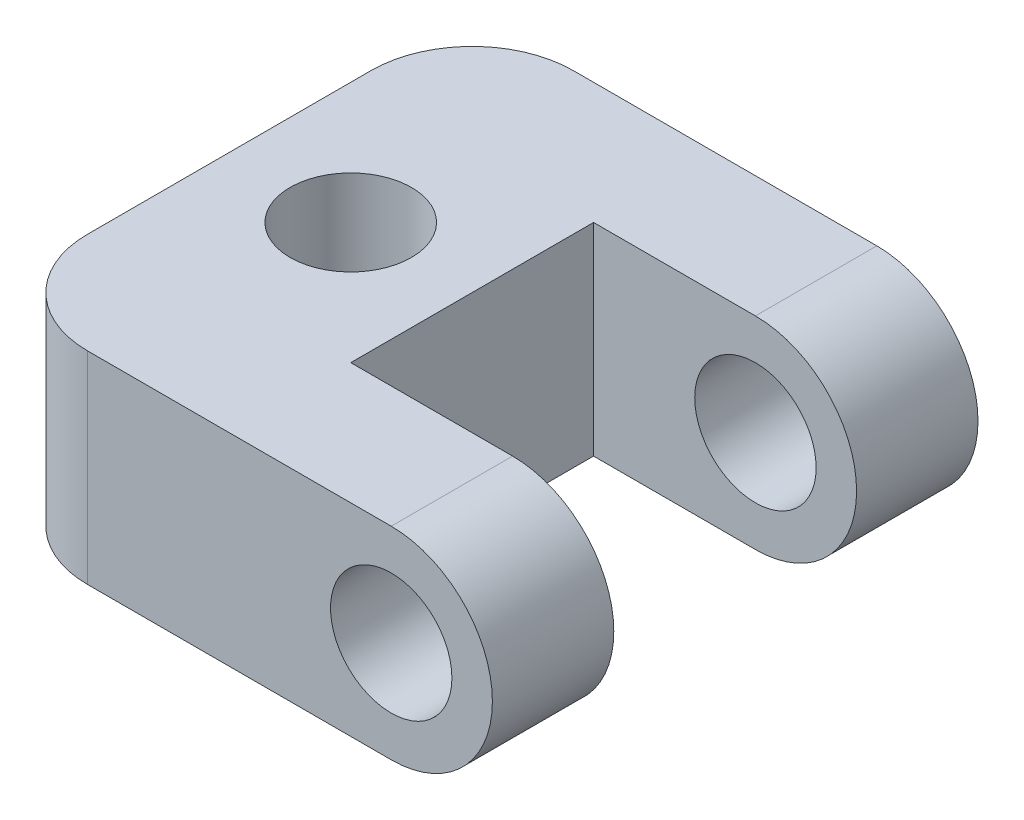
from build123d import *

# Parameters (mm, degrees)
BOSS_EXTRUDE1_DEPTH = 12
SKETCH2_W           = 6.5
SKETCH2_H           = 6
CUT_EXTRUDE1_DEPTH  = 19.034688797
SKETCH3_R           = 1.5
CUT_EXTRUDE2_DEPTH  = 12
SKETCH6_R           = 1.5
CUT_EXTRUDE3_DEPTH  = 19.034688797
FILLET1_R           = 2.5


with BuildPart() as part:
    # Sketch1 → Boss-Extrude1 (new body)
    with BuildSketch(Plane.XY):
        with BuildLine():
            Line((0, 0), (10, 0))
            ThreePointArc((10, 0), (12.5, 2.5), (10, 5))
            Line((10, 5), (0, 5))
            Line((0, 5), (0, 0))
        make_face()
    extrude(amount=-BOSS_EXTRUDE1_DEPTH)

    # Sketch2 → Cut-Extrude1 (cut, through all)
    with BuildSketch(Plane(origin=(0, 5, 0), x_dir=(1, 0, 0), z_dir=(0, 1, 0))):
        with Locations((9.25, 6)):
            Rectangle(SKETCH2_W, SKETCH2_H)
    extrude(amount=-CUT_EXTRUDE1_DEPTH, mode=Mode.SUBTRACT)

    # Sketch3 → Cut-Extrude2 (cut)
    with BuildSketch(Plane.XY):
        with Locations((10, 2.5)):
            Circle(SKETCH3_R)
    extrude(amount=-CUT_EXTRUDE2_DEPTH, mode=Mode.SUBTRACT)

    # Sketch6 → Cut-Extrude3 (cut, through all)
    with BuildSketch(Plane(origin=(0, 5, 0), x_dir=(1, 0, 0), z_dir=(0, 1, 0))):
        with Locations(Location((3, 6, 0), (0, 0, 270))):
            Circle(SKETCH6_R)
    extrude(amount=-CUT_EXTRUDE3_DEPTH, mode=Mode.SUBTRACT)

    # Fillet1
    fillet1_edges = [part.edges().sort_by_distance(p)[0] for p in [
        (0, 2.5, -12),
        (0, 2.5, 0),
    ]]
    fillet(fillet1_edges, radius=FILLET1_R)


solid = part.part
